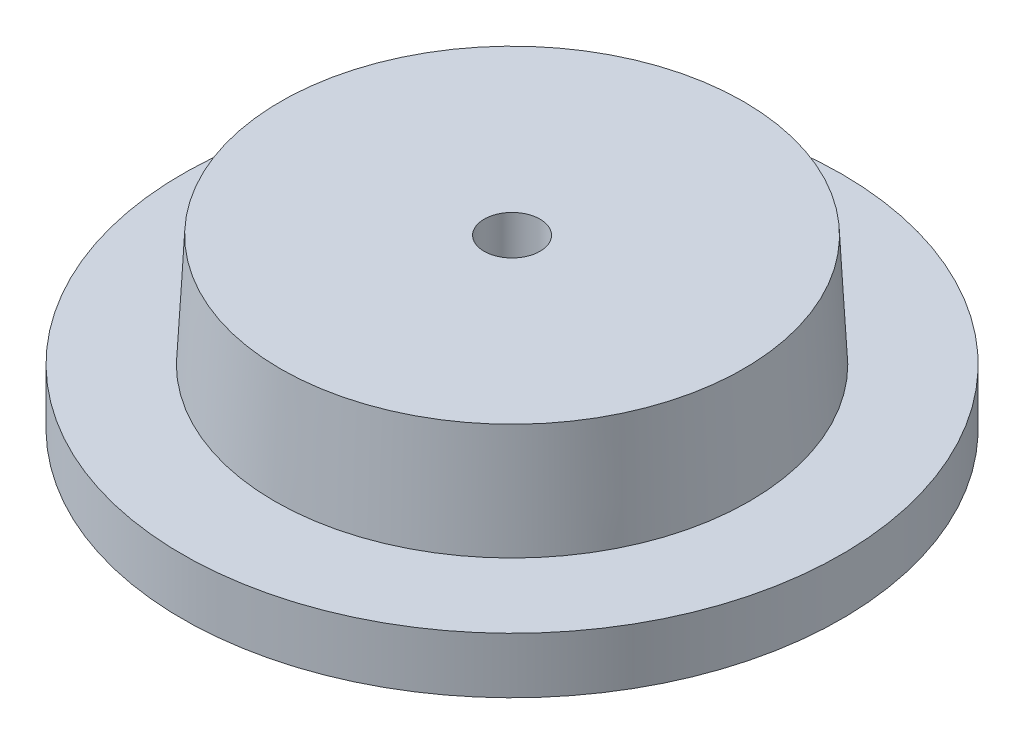
from build123d import *

# Parameters (mm, degrees)
SKETCH1_R           = 2.125
BOSS_EXTRUDE1_DEPTH = 1
BOSS_EXTRUDE1_TAPER = 3
SKETCH2_R           = 2.95
BOSS_EXTRUDE2_DEPTH = 0.5
SKETCH3_R           = 0.25
CUT_EXTRUDE1_DEPTH  = 5.43339599


with BuildPart() as part:
    # Sketch1 → Boss-Extrude1 (new body)
    with BuildSketch(Plane(origin=(0, 0, 0), x_dir=(1, 0, 0), z_dir=(0, 1, 0))):
        Circle(SKETCH1_R)
    extrude(amount=BOSS_EXTRUDE1_DEPTH, taper=BOSS_EXTRUDE1_TAPER)

    # Sketch2 → Boss-Extrude2 (add)
    with BuildSketch(Plane.XZ):
        with Locations(Location((0, 0, 0), (0, 0, 270))):
            Circle(SKETCH2_R)
    extrude(amount=BOSS_EXTRUDE2_DEPTH)

    # Sketch3 → Cut-Extrude1 (cut, through all)
    with BuildSketch(Plane(origin=(0, 1, 0), x_dir=(1, 0, 0), z_dir=(0, 1, 0))):
        with Locations(Location((0, 0, 0), (0, 0, 270))):
            Circle(SKETCH3_R)
    extrude(amount=-CUT_EXTRUDE1_DEPTH, mode=Mode.SUBTRACT)


solid = part.part
